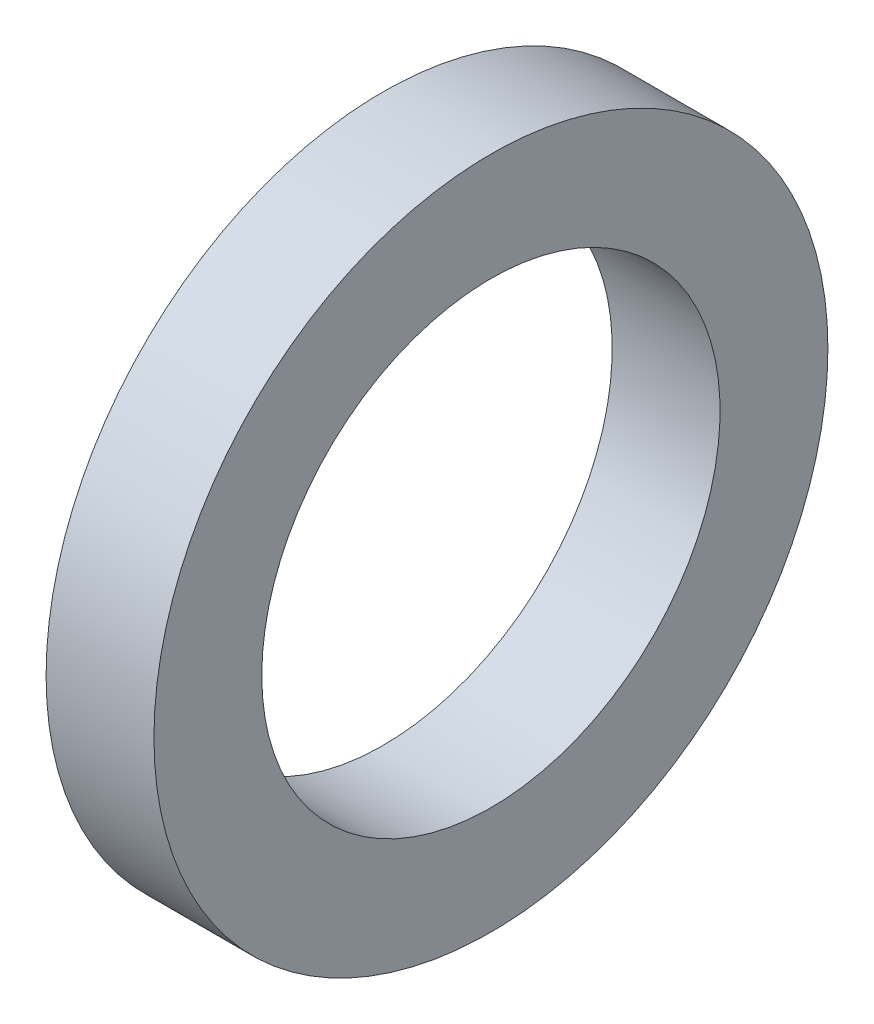
from build123d import *

# Parameters (mm, degrees)
SKETCH1_W = 1
SKETCH1_H = 1


with BuildPart() as part:
    # Sketch1 → Revolve1 (revolve)
    with BuildSketch(Plane.XY, mode=Mode.PRIVATE) as revolve1_sk:
        with Locations((0, 2.625)):
            Rectangle(SKETCH1_W, SKETCH1_H)
    revolve(revolve1_sk.sketch.rotate(Axis((-3.887142857, 0, 0), (1, 0, 0)), 90), axis=Axis((-3.887142857, 0, 0), (1, 0, 0)))


solid = part.part
